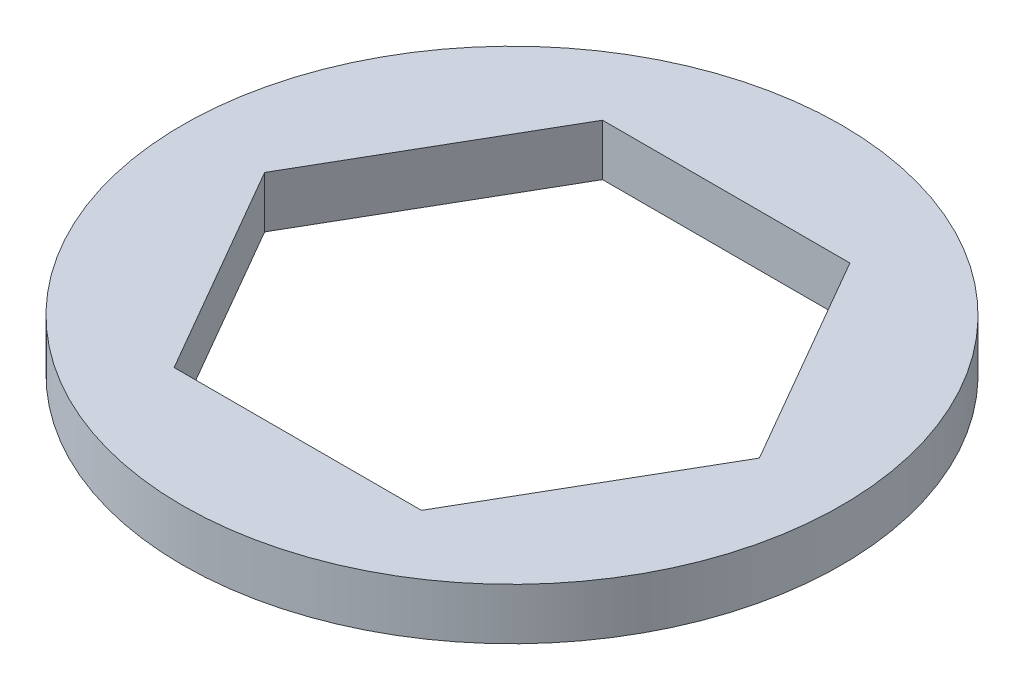
from build123d import *

# Parameters (mm, degrees)
SKETCH1_R           = 10.16
BOSS_EXTRUDE1_DEPTH = 0.79375


with BuildPart() as part:
    # Sketch1 → Boss-Extrude1 (new, symmetric)
    with BuildSketch(Plane(origin=(0, 0, 0), x_dir=(1, 0, 0), z_dir=(0, 1, 0))):
        with Locations(Location((0, 0, 0), (0, 0, 270))):
            Circle(SKETCH1_R)
        Polygon((7.625642355, 0), (3.812821178, 6.604), (-3.812821178, 6.604), (-7.625642355, 0), (-3.812821178, -6.604), (3.812821178, -6.604), align=None, mode=Mode.SUBTRACT)
    extrude(amount=BOSS_EXTRUDE1_DEPTH, both=True)


solid = part.part
